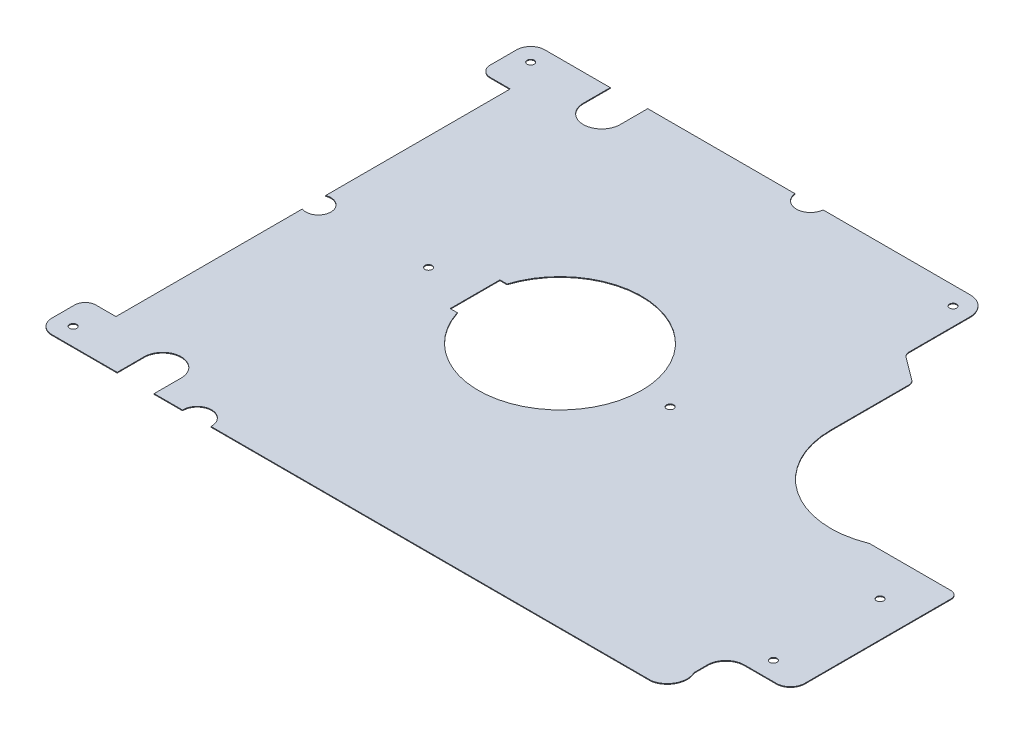
from build123d import *

# Parameters (mm, degrees)
EXTRUIR1_DEPTH = 0.1
CROQUIS2_R     = 0.5
EXTRUIR2_DEPTH = 61.742680558


with BuildPart() as part:
    # Croquis1 → Extruir1 (new body)
    with BuildSketch(Plane(origin=(0, 0, 0), x_dir=(1, 0, 0), z_dir=(0, 1, 0))):
        with BuildLine():
            Line((-33.4, 34.774386262), (-12.68172335, 34.774386262))
            ThreePointArc((-12.68172335, 34.774386262), (-10.693196053, 32.988300237), (-8.704668756, 34.774386262))
            Line((-8.704668756, 34.774386262), (11.804147498, 34.774386262))
            ThreePointArc((11.804147498, 34.774386262), (13.808796801, 34.052242285), (14.654898518, 32.096680311))
            Line((14.654898518, 32.096680311), (14.654898518, 23.480332981))
            ThreePointArc((14.654898518, 23.480332981), (14.760471327, 23.033119386), (15.054898518, 22.680332981))
            Line((15.054898518, 22.680332981), (18.254898518, 20.280332981))
            ThreePointArc((18.254898518, 20.280332981), (18.549325709, 19.927546577), (18.654898518, 19.480332981))
            Line((18.654898518, 19.480332981), (18.654898518, 8.480332981))
            ThreePointArc((18.654898518, 8.480332981), (23.890263788, -1.431262096), (35.028184679, -2.694387067))
            ThreePointArc((35.028184679, -2.694387067), (35.207188776, -2.642957473), (35.392625193, -2.625613738))
            Line((35.392625193, -2.625613738), (46.7, -2.625613738))
            ThreePointArc((46.7, -2.625613738), (47.407106781, -2.918506956), (47.7, -3.625613738))
            Line((47.7, -3.625613738), (47.7, -24.225613738))
            ThreePointArc((47.7, -24.225613738), (47.114213562, -25.6398273), (45.7, -26.225613738))
            Line((45.7, -26.225613738), (41.2, -26.225613738))
            ThreePointArc((41.2, -26.225613738), (39.361522369, -26.987136107), (38.6, -28.825613738))
            Line((38.6, -28.825613738), (38.6, -30.725613738))
            ThreePointArc((38.6, -30.725613738), (38.584277466, -33.205559421), (36.605129886, -34.7))
            Line((36.605129886, -34.7), (-25.401383808, -34.7))
            ThreePointArc((-25.401383808, -34.7), (-27.4, -32.625613738), (-29.398616192, -34.7))
            Line((-29.398616192, -34.7), (-33.4, -34.7))
            Line((-33.4, -34.7), (-33.4, -30.9))
            ThreePointArc((-33.4, -30.9), (-36, -28.3), (-38.6, -30.9))
            Line((-38.6, -30.9), (-38.6, -34.7))
            Line((-38.6, -34.7), (-47.8, -34.7))
            ThreePointArc((-47.8, -34.7), (-49.214213562, -34.114213562), (-49.8, -32.7))
            Line((-49.8, -32.7), (-49.8, -29.5))
            ThreePointArc((-49.8, -29.5), (-49.360660172, -28.439339828), (-48.3, -28))
            Line((-48.3, -28), (-45.478700604, -28))
            Line((-45.478700604, -28), (-45.478700604, -1.775613738))
            ThreePointArc((-45.478700604, -1.775613738), (-43.1, -0.125613738), (-45.478700604, 1.524386262))
            Line((-45.478700604, 1.524386262), (-45.478700604, 27.5))
            Line((-45.478700604, 27.5), (-48.3, 27.5))
            ThreePointArc((-48.3, 27.5), (-49.360660172, 27.939339828), (-49.8, 29))
            Line((-49.8, 29), (-49.8, 32.7))
            ThreePointArc((-49.8, 32.7), (-49.214213562, 34.114213562), (-47.8, 34.7))
            Line((-47.8, 34.7), (-38.6, 34.7))
            Line((-38.6, 34.7), (-38.6, 30.9))
            ThreePointArc((-38.6, 30.9), (-36, 28.3), (-33.4, 30.9))
            Line((-33.4, 30.9), (-33.4, 34.774386262))
        make_face()
    extrude(amount=EXTRUIR1_DEPTH)

    # Croquis2 → Extruir2 (cut, through all)
    with BuildSketch(Plane(origin=(0, 0.1, 0), x_dir=(1, 0, 0), z_dir=(0, 1, 0))):
        with Locations(Location((-29.478700604, 0, 0), (0, 0, 270))):
            Circle(CROQUIS2_R)
        with Locations(Location((-47.3, 32.2, 0), (0, 0, 270))):
            Circle(CROQUIS2_R)
        with Locations(Location((-47.3, -32.2, 0), (0, 0, 270))):
            Circle(CROQUIS2_R)
        with Locations(Location((12.154898518, 32.2, 0), (0, 0, 270))):
            Circle(CROQUIS2_R)
        with Locations(Location((4.521299396, 0, 0), (0, 0, 270))):
            Circle(CROQUIS2_R)
        with Locations(Location((42.7, -8.625613738, 0), (0, 0, 270))):
            Circle(CROQUIS2_R)
        with Locations(Location((42.7, -23.625613738, 0), (0, 0, 270))):
            Circle(CROQUIS2_R)
        with BuildLine():
            Line((-22.933151754, 3.5), (-21.933151754, 3.5))
            ThreePointArc((-21.933151754, 3.5), (0.521299396, 0), (-21.933151754, -3.5))
            Line((-21.933151754, -3.5), (-22.933151754, -3.5))
            Line((-22.933151754, -3.5), (-22.933151754, 3.5))
        make_face()
    extrude(amount=-EXTRUIR2_DEPTH, mode=Mode.SUBTRACT)


solid = part.part
